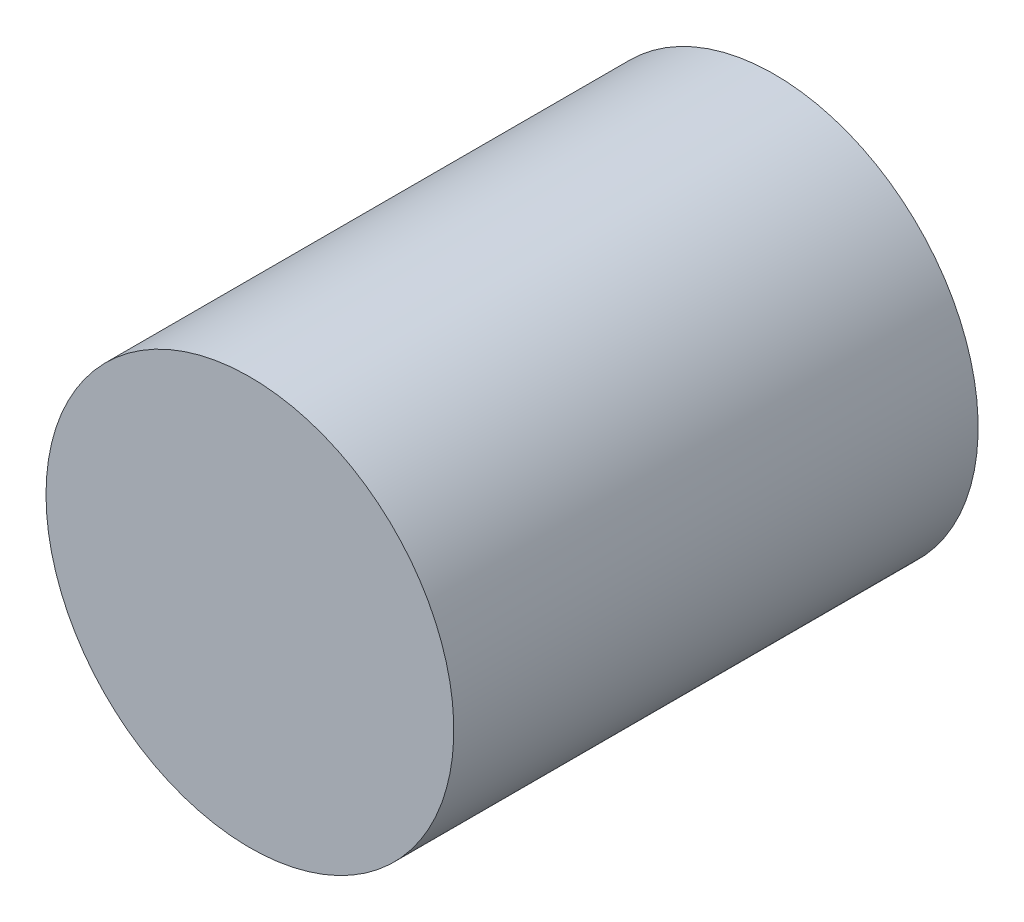
from build123d import *

# Parameters (mm, degrees)
SKETCH1_R           = 17.5
BOSS_EXTRUDE1_DEPTH = 45


with BuildPart() as part:
    # Sketch1 → Boss-Extrude1 (new body)
    with BuildSketch(Plane.XY):
        with Locations(Location((0, 0, 0), (0, 0, 180))):
            Circle(SKETCH1_R)
    extrude(amount=BOSS_EXTRUDE1_DEPTH)


solid = part.part
